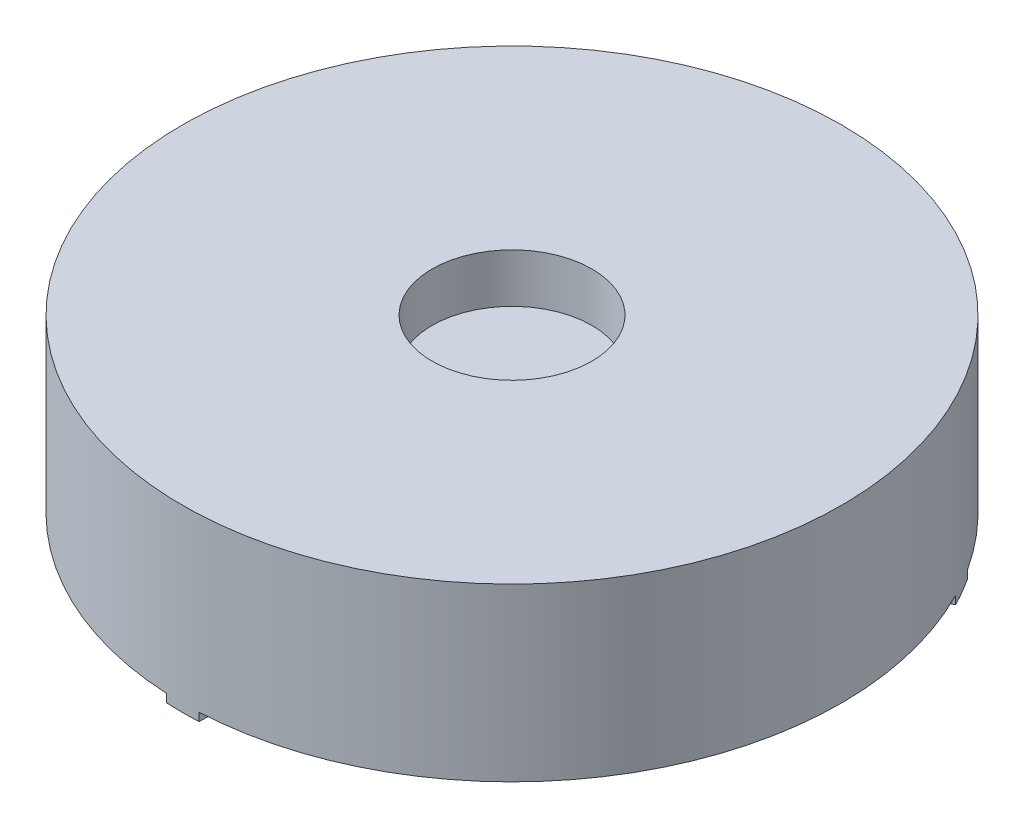
from build123d import *
from build123d.topology import SkipClean

# Parameters (mm, degrees)
BOSS_EXTRUDE1_START = 0.5
BOSS_EXTRUDE1_DEPTH = 0.5
SKETCH3_R           = 0.5
BOSS_EXTRUDE2_DEPTH = 3.1


with BuildPart() as part:
    # Sketch1 → Revolve1 (revolve)
    with BuildSketch(Plane(origin=(0, 0, 0), x_dir=(0, 0, -1), z_dir=(1, 0, 0))):
        Polygon((20.2, 10.5), (20.2, 0), (0, 0), (0, 7.5), (4.9, 7.5), (4.9, 10.5), align=None)
    revolve(axis=Axis((0, 0, 0), (0, 1, 0)))

    # Sketch2 → Boss-Extrude1 (add)
    with SkipClean():  # the faces are left unmerged after this step: merging them gives an invalid solid
        with BuildSketch(Plane.XZ.offset(BOSS_EXTRUDE1_START)):
            with BuildLine():
                Line((-1, 20.175232341), (-1, 19.173940649))
                ThreePointArc((-1, 19.173940649), (0, 19.2), (1, 19.173940649))
                Line((1, 19.173940649), (1, 20.175232341))
                ThreePointArc((1, 20.175232341), (0, 20.2), (-1, 20.175232341))
            make_face()
            with BuildLine():
                Line((17.972263734, -9.221590767), (17.105119692, -8.720944921))
                ThreePointArc((17.105119692, -8.720944921), (16.627687753, -9.6), (16.105119692, -10.452995728))
                Line((16.105119692, -10.452995728), (16.972263734, -10.953641574))
                ThreePointArc((16.972263734, -10.953641574), (17.493713156, -10.1), (17.972263734, -9.221590767))
            make_face()
            with BuildLine():
                Line((-16.972263734, -10.953641574), (-16.105119692, -10.452995728))
                ThreePointArc((-16.105119692, -10.452995728), (-16.627687753, -9.6), (-17.105119692, -8.720944921))
                Line((-17.105119692, -8.720944921), (-17.972263734, -9.221590767))
                ThreePointArc((-17.972263734, -9.221590767), (-17.493713156, -10.1), (-16.972263734, -10.953641574))
            make_face()
        extrude(amount=-BOSS_EXTRUDE1_DEPTH)

    # Sketch3 → Boss-Extrude2 (add)
    with SkipClean():  # the faces are left unmerged after this step: merging them gives an invalid solid
        with BuildSketch(Plane.XZ):
            with Locations(Location((0, 4, 0), (0, 0, 270))):
                Circle(SKETCH3_R)
            with Locations(Location((0, -14.5, 0), (0, 0, 270))):
                Circle(SKETCH3_R)
        extrude(amount=BOSS_EXTRUDE2_DEPTH)


solid = part.part
